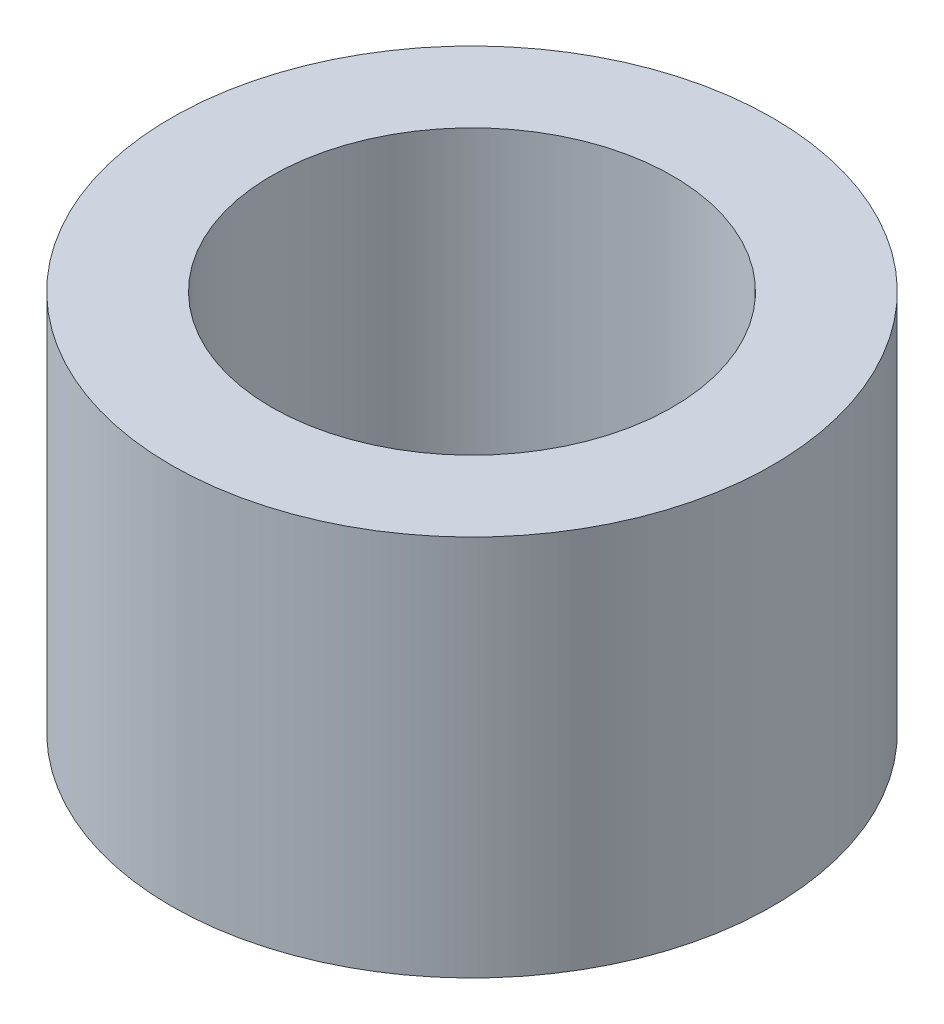
from build123d import *

# Parameters (mm, degrees)
SKETCH1_R           = 3.15
SKETCH1_R_2         = 2.1
BOSS_EXTRUDE1_DEPTH = 4


with BuildPart() as part:
    # Sketch1 → Boss-Extrude1 (new body)
    with BuildSketch(Plane(origin=(0, 0, 0), x_dir=(1, 0, 0), z_dir=(0, 1, 0))):
        with Locations(Location((0, 0, 0), (0, 0, 270))):
            Circle(SKETCH1_R)
        with Locations(Location((0, 0, 0), (0, 0, 270))):
            Circle(SKETCH1_R_2, mode=Mode.SUBTRACT)
    extrude(amount=BOSS_EXTRUDE1_DEPTH)


solid = part.part
